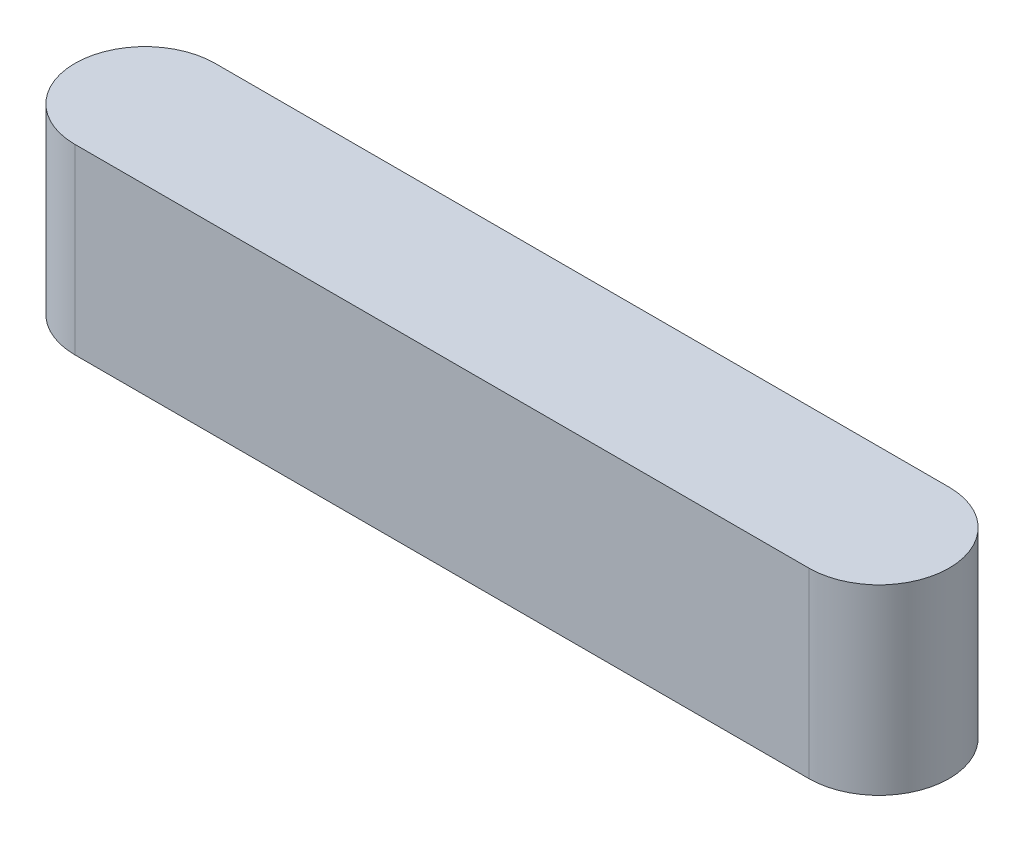
from build123d import *

# Parameters (mm, degrees)
BOSS_EXTRUDE1_DEPTH = 7.8


with BuildPart() as part:
    # Sketch1 → Boss-Extrude1 (new body)
    with BuildSketch(Plane(origin=(0, 0, 0), x_dir=(1, 0, 0), z_dir=(0, 1, 0))):
        with BuildLine():
            Line((0, 3), (31.4, 3))
            ThreePointArc((31.4, 3), (34.4, 0), (31.4, -3))
            Line((31.4, -3), (0, -3))
            ThreePointArc((0, -3), (-3, 0), (0, 3))
        make_face()
    extrude(amount=BOSS_EXTRUDE1_DEPTH)


solid = part.part
